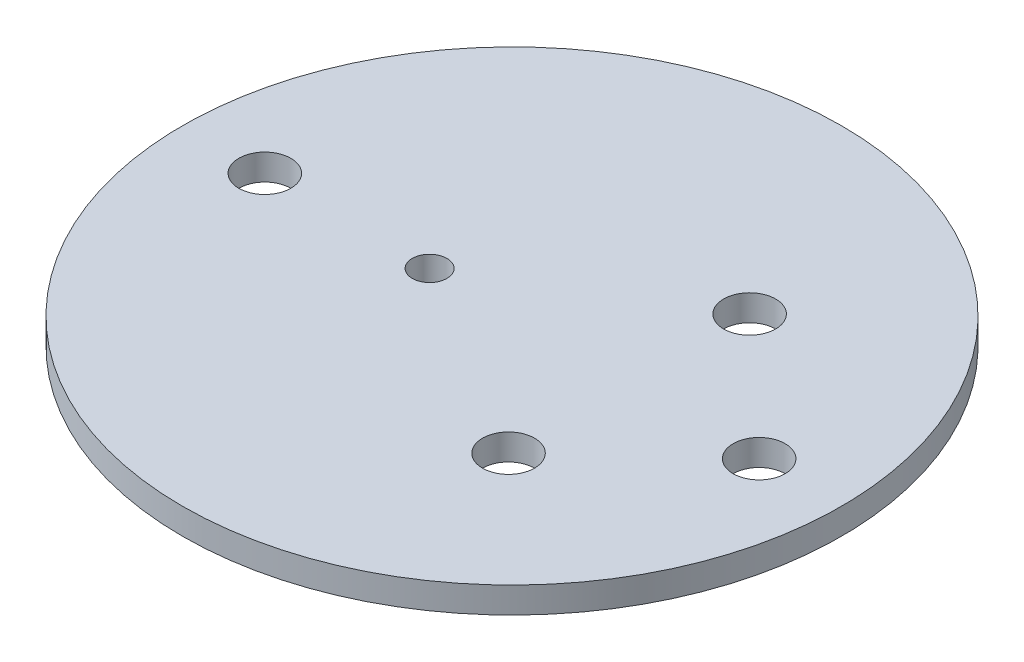
from build123d import *

# Parameters (mm, degrees)
SKETCH1_R           = 38
SKETCH1_R_2         = 3
SKETCH1_R_3         = 2
BOSS_EXTRUDE1_DEPTH = 3


with BuildPart() as part:
    # Sketch1 → Boss-Extrude1 (new body)
    with BuildSketch(Plane(origin=(0, 0, 0), x_dir=(1, 0, 0), z_dir=(0, 1, 0))):
        with Locations(Location((0, 0, 0), (0, 0, 270))):
            Circle(SKETCH1_R)
        with Locations(Location((28.5, 0, 0), (0, 0, 270))):
            Circle(SKETCH1_R_2, mode=Mode.SUBTRACT)
        with Locations(Location((-28.5, 0, 0), (0, 0, 270))):
            Circle(SKETCH1_R_2, mode=Mode.SUBTRACT)
        with Locations(Location((13.5, 13.9, 0), (0, 0, 270))):
            Circle(SKETCH1_R_2, mode=Mode.SUBTRACT)
        with Locations(Location((13.5, -13.9, 0), (0, 0, 270))):
            Circle(SKETCH1_R_2, mode=Mode.SUBTRACT)
        with Locations(Location((-9.5, 0, 0), (0, 0, 270))):
            Circle(SKETCH1_R_3, mode=Mode.SUBTRACT)
    extrude(amount=-BOSS_EXTRUDE1_DEPTH)


solid = part.part
